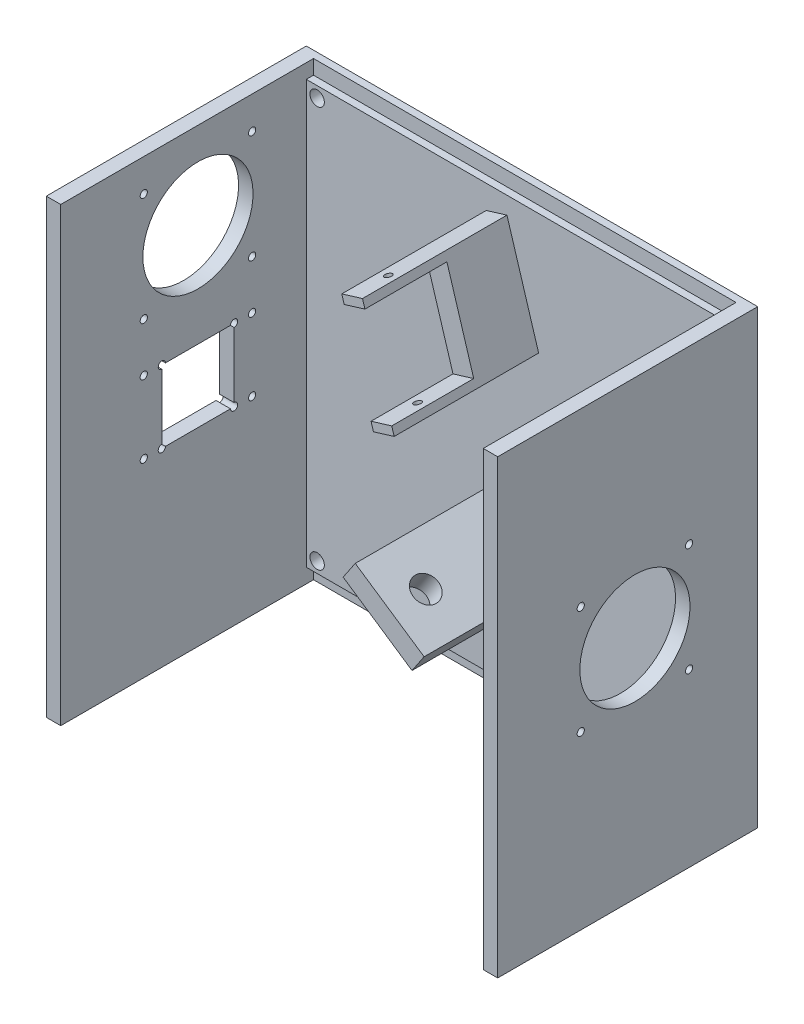
from build123d import *

# Parameters (mm, degrees)
SKIZZE1_W                       = 125
SKIZZE1_H                       = 125
AUFSATZ_LINEAR_AUSTRAGEN1_DEPTH = 2
SKIZZE2_W                       = 117
SKIZZE2_H                       = 117
AUFSATZ_LINEAR_AUSTRAGEN2_DEPTH = 2
SKIZZE3_R                       = 2
SCHNITT_LINEAR_AUSTRAGEN1_DEPTH = 32
AUFSATZ_LINEAR_AUSTRAGEN3_DEPTH = 40
SKIZZE8_R                       = 1
SCHNITT_LINEAR_AUSTRAGEN3_DEPTH = 40
SKIZZE9_R                       = 3.493135661
SCHNITT_LINEAR_AUSTRAGEN4_DEPTH = 20
SKIZZE10_W                      = 4
SKIZZE10_H                      = 125
AUFSATZ_LINEAR_AUSTRAGEN4_DEPTH = 70
SKIZZE11_R                      = 15.25
SKIZZE11_R_2                    = 1
SCHNITT_LINEAR_AUSTRAGEN5_DEPTH = 10
SKIZZE12_R                      = 15.25
SKIZZE12_R_2                    = 1
SKIZZE12_W                      = 20
SKIZZE12_H                      = 20
SCHNITT_LINEAR_AUSTRAGEN6_DEPTH = 12
SKIZZE13_R                      = 1
SCHNITT_LINEAR_AUSTRAGEN7_DEPTH = 10
SCHNITT_LINEAR_AUSTRAGEN8_DEPTH = 22.7


with BuildPart() as part:
    # Skizze1 → Aufsatz-Linear austragen1 (new body)
    with BuildSketch(Plane.XY):
        with Locations((62.5, 62.5)):
            Rectangle(SKIZZE1_W, SKIZZE1_H)
    extrude(amount=AUFSATZ_LINEAR_AUSTRAGEN1_DEPTH)

    # Skizze2 → Aufsatz-Linear austragen2 (add)
    with BuildSketch(Plane.XY.offset(2)):
        with Locations((62.5, 62.5)):
            Rectangle(SKIZZE2_W, SKIZZE2_H)
    extrude(amount=AUFSATZ_LINEAR_AUSTRAGEN2_DEPTH)

    # Skizze3 → Schnitt-Linear austragen1 (cut)
    with BuildSketch(Plane.XY.offset(4)):
        with Locations((7, 118)):
            Circle(SKIZZE3_R)
        with Locations((7, 7)):
            Circle(SKIZZE3_R)
        with Locations((118, 7)):
            Circle(SKIZZE3_R)
        with Locations((118, 118)):
            Circle(SKIZZE3_R)
    extrude(amount=-SCHNITT_LINEAR_AUSTRAGEN1_DEPTH, mode=Mode.SUBTRACT)

    # Skizze4 → Aufsatz-Linear austragen3 (add)
    with BuildSketch(Plane.XY.offset(4)):
        Polygon((62.595258591, 85.778313546), (68.333087126, 87.532543775), (59.561935985, 116.221686454), (53.824107449, 114.467456225), align=None)
        Polygon((54.200560001, 46.732563956), (73.26842417, 33.871127177), (76.623581591, 38.845352612), (57.555717422, 51.706789392), align=None)
    extrude(amount=AUFSATZ_LINEAR_AUSTRAGEN3_DEPTH)

    # Skizze8 → Schnitt-Linear austragen3 (cut)
    with BuildSketch(Plane(origin=(-27.403744567, 89.633609675, 0), x_dir=(0.9563047559630352, 0.2923717047227376, 0), z_dir=(-0.29237170472273766, 0.9563047559630353, 0))):
        with Locations(Location((87.939295251, -34, 0), (0, 0, 180))):
            Circle(SKIZZE8_R)
    extrude(amount=-SCHNITT_LINEAR_AUSTRAGEN3_DEPTH, mode=Mode.SUBTRACT)

    # Skizze9 → Schnitt-Linear austragen4 (cut)
    with BuildSketch(Plane(origin=(41.968333241, 62.220612777, 0), x_dir=(0.8290375725550413, -0.5591929034707476, 0), z_dir=(0.5591929034707476, 0.8290375725550413, 0))):
        with Locations(Location((30.301782569, -34, 0), (0, 0, 180))):
            Circle(SKIZZE9_R)
    extrude(amount=-SCHNITT_LINEAR_AUSTRAGEN4_DEPTH, mode=Mode.SUBTRACT)

    # Skizze10 → Aufsatz-Linear austragen4 (add)
    with BuildSketch(Plane.XY.offset(2)):
        with Locations((123, 62.5)):
            Rectangle(SKIZZE10_W, SKIZZE10_H)
        with Locations((2, 62.5)):
            Rectangle(SKIZZE10_W, SKIZZE10_H)
    extrude(amount=AUFSATZ_LINEAR_AUSTRAGEN4_DEPTH)

    # Skizze11 → Schnitt-Linear austragen5 (cut)
    with BuildSketch(Plane(origin=(125, 0, 0), x_dir=(0, 0, -1), z_dir=(1, 0, 0))):
        with Locations((-34, 62.5)):
            Circle(SKIZZE11_R)
        with Locations((-49, 47.5)):
            Circle(SKIZZE11_R_2)
        with Locations((-19, 47.5)):
            Circle(SKIZZE11_R_2)
        with Locations((-49, 77.5)):
            Circle(SKIZZE11_R_2)
        with Locations((-19, 77.5)):
            Circle(SKIZZE11_R_2)
    extrude(amount=-SCHNITT_LINEAR_AUSTRAGEN5_DEPTH, mode=Mode.SUBTRACT)

    # Skizze12 → Schnitt-Linear austragen6 (cut)
    with BuildSketch(Plane.ZY):
        with Locations((34, 101)):
            Circle(SKIZZE12_R)
        with Locations((19, 116)):
            Circle(SKIZZE12_R_2)
        with Locations((49, 116)):
            Circle(SKIZZE12_R_2)
        with Locations((49, 86)):
            Circle(SKIZZE12_R_2)
        with Locations((19, 86)):
            Circle(SKIZZE12_R_2)
        with Locations((19, 72.5)):
            Circle(SKIZZE12_R_2)
        with Locations((49, 72.5)):
            Circle(SKIZZE12_R_2)
        with Locations((49, 52.5)):
            Circle(SKIZZE12_R_2)
        with Locations((19, 52.5)):
            Circle(SKIZZE12_R_2)
        with Locations((34, 62.5)):
            Rectangle(SKIZZE12_W, SKIZZE12_H)
    extrude(amount=-SCHNITT_LINEAR_AUSTRAGEN6_DEPTH, mode=Mode.SUBTRACT)

    # Skizze13 → Schnitt-Linear austragen7 (cut)
    with BuildSketch(Plane.ZY):
        with Locations((24, 52.5)):
            Circle(SKIZZE13_R)
        with Locations((44, 52.5)):
            Circle(SKIZZE13_R)
        with Locations((24, 72.5)):
            Circle(SKIZZE13_R)
        with Locations((44, 72.5)):
            Circle(SKIZZE13_R)
    extrude(amount=-SCHNITT_LINEAR_AUSTRAGEN7_DEPTH, mode=Mode.SUBTRACT)

    # Skizze7 → Schnitt-Linear austragen8 (cut)
    with BuildSketch(Plane.XY.offset(44)):
        Polygon((54.49656237, 112.267955287), (60.234390906, 114.022185515), (67.660632206, 89.732044713), (61.92280367, 87.977814485), align=None)
    extrude(amount=-SCHNITT_LINEAR_AUSTRAGEN8_DEPTH, mode=Mode.SUBTRACT)


solid = part.part
